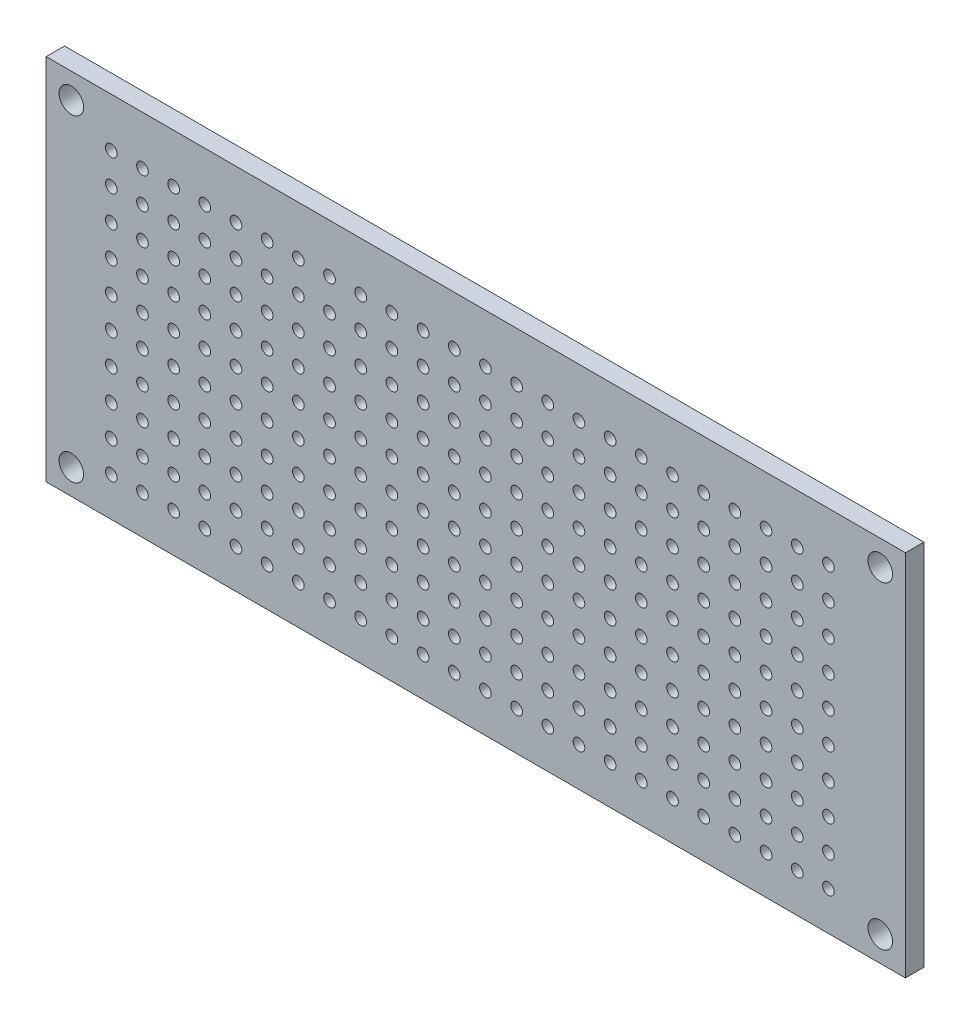
from build123d import *

# Parameters (mm, degrees)
SKIZZE1_W                       = 70
SKIZZE1_H                       = 30
SKIZZE1_R                       = 1
SKIZZE1_R_2                     = 0.475
AUFSATZ_LINEAR_AUSTRAGEN1_DEPTH = 1.5


with BuildPart() as part:
    # Skizze1 → Aufsatz-Linear austragen1 (new body)
    with BuildSketch(Plane.XY):
        with Locations((35, 15)):
            Rectangle(SKIZZE1_W, SKIZZE1_H)
        with Locations((67.95, 27.95)):
            Circle(SKIZZE1_R, mode=Mode.SUBTRACT)
        with Locations((67.95, 2.05)):
            Circle(SKIZZE1_R, mode=Mode.SUBTRACT)
        with Locations((2.05, 2.05)):
            Circle(SKIZZE1_R, mode=Mode.SUBTRACT)
        with Locations((2.05, 27.95)):
            Circle(SKIZZE1_R, mode=Mode.SUBTRACT)
        with Locations((63.725, 26.025)):
            Circle(SKIZZE1_R_2, mode=Mode.SUBTRACT)
        with Locations((61.185, 26.025)):
            Circle(SKIZZE1_R_2, mode=Mode.SUBTRACT)
        with Locations((58.645, 26.025)):
            Circle(SKIZZE1_R_2, mode=Mode.SUBTRACT)
        with Locations((56.105, 26.025)):
            Circle(SKIZZE1_R_2, mode=Mode.SUBTRACT)
        with Locations((53.565, 26.025)):
            Circle(SKIZZE1_R_2, mode=Mode.SUBTRACT)
        with Locations((51.025, 26.025)):
            Circle(SKIZZE1_R_2, mode=Mode.SUBTRACT)
        with Locations((48.485, 26.025)):
            Circle(SKIZZE1_R_2, mode=Mode.SUBTRACT)
        with Locations((45.945, 26.025)):
            Circle(SKIZZE1_R_2, mode=Mode.SUBTRACT)
        with Locations((43.405, 26.025)):
            Circle(SKIZZE1_R_2, mode=Mode.SUBTRACT)
        with Locations((40.865, 26.025)):
            Circle(SKIZZE1_R_2, mode=Mode.SUBTRACT)
        with Locations((38.325, 26.025)):
            Circle(SKIZZE1_R_2, mode=Mode.SUBTRACT)
        with Locations((35.785, 26.025)):
            Circle(SKIZZE1_R_2, mode=Mode.SUBTRACT)
        with Locations((33.245, 26.025)):
            Circle(SKIZZE1_R_2, mode=Mode.SUBTRACT)
        with Locations((30.705, 26.025)):
            Circle(SKIZZE1_R_2, mode=Mode.SUBTRACT)
        with Locations((28.165, 26.025)):
            Circle(SKIZZE1_R_2, mode=Mode.SUBTRACT)
        with Locations((25.625, 26.025)):
            Circle(SKIZZE1_R_2, mode=Mode.SUBTRACT)
        with Locations((23.085, 26.025)):
            Circle(SKIZZE1_R_2, mode=Mode.SUBTRACT)
        with Locations((20.545, 26.025)):
            Circle(SKIZZE1_R_2, mode=Mode.SUBTRACT)
        with Locations((18.005, 26.025)):
            Circle(SKIZZE1_R_2, mode=Mode.SUBTRACT)
        with Locations((15.465, 26.025)):
            Circle(SKIZZE1_R_2, mode=Mode.SUBTRACT)
        with Locations((12.925, 26.025)):
            Circle(SKIZZE1_R_2, mode=Mode.SUBTRACT)
        with Locations((10.385, 26.025)):
            Circle(SKIZZE1_R_2, mode=Mode.SUBTRACT)
        with Locations((7.845, 26.025)):
            Circle(SKIZZE1_R_2, mode=Mode.SUBTRACT)
        with Locations((5.305, 26.025)):
            Circle(SKIZZE1_R_2, mode=Mode.SUBTRACT)
        with Locations((61.185, 23.485)):
            Circle(SKIZZE1_R_2, mode=Mode.SUBTRACT)
        with Locations((58.645, 23.485)):
            Circle(SKIZZE1_R_2, mode=Mode.SUBTRACT)
        with Locations((56.105, 23.485)):
            Circle(SKIZZE1_R_2, mode=Mode.SUBTRACT)
        with Locations((53.565, 23.485)):
            Circle(SKIZZE1_R_2, mode=Mode.SUBTRACT)
        with Locations((51.025, 23.485)):
            Circle(SKIZZE1_R_2, mode=Mode.SUBTRACT)
        with Locations((48.485, 23.485)):
            Circle(SKIZZE1_R_2, mode=Mode.SUBTRACT)
        with Locations((45.945, 23.485)):
            Circle(SKIZZE1_R_2, mode=Mode.SUBTRACT)
        with Locations((43.405, 23.485)):
            Circle(SKIZZE1_R_2, mode=Mode.SUBTRACT)
        with Locations((40.865, 23.485)):
            Circle(SKIZZE1_R_2, mode=Mode.SUBTRACT)
        with Locations((38.325, 23.485)):
            Circle(SKIZZE1_R_2, mode=Mode.SUBTRACT)
        with Locations((35.785, 23.485)):
            Circle(SKIZZE1_R_2, mode=Mode.SUBTRACT)
        with Locations((33.245, 23.485)):
            Circle(SKIZZE1_R_2, mode=Mode.SUBTRACT)
        with Locations((30.705, 23.485)):
            Circle(SKIZZE1_R_2, mode=Mode.SUBTRACT)
        with Locations((28.165, 23.485)):
            Circle(SKIZZE1_R_2, mode=Mode.SUBTRACT)
        with Locations((25.625, 23.485)):
            Circle(SKIZZE1_R_2, mode=Mode.SUBTRACT)
        with Locations((23.085, 23.485)):
            Circle(SKIZZE1_R_2, mode=Mode.SUBTRACT)
        with Locations((20.545, 23.485)):
            Circle(SKIZZE1_R_2, mode=Mode.SUBTRACT)
        with Locations((18.005, 23.485)):
            Circle(SKIZZE1_R_2, mode=Mode.SUBTRACT)
        with Locations((15.465, 23.485)):
            Circle(SKIZZE1_R_2, mode=Mode.SUBTRACT)
        with Locations((12.925, 23.485)):
            Circle(SKIZZE1_R_2, mode=Mode.SUBTRACT)
        with Locations((10.385, 23.485)):
            Circle(SKIZZE1_R_2, mode=Mode.SUBTRACT)
        with Locations((7.845, 23.485)):
            Circle(SKIZZE1_R_2, mode=Mode.SUBTRACT)
        with Locations((5.305, 23.485)):
            Circle(SKIZZE1_R_2, mode=Mode.SUBTRACT)
        with Locations((61.185, 20.945)):
            Circle(SKIZZE1_R_2, mode=Mode.SUBTRACT)
        with Locations((58.645, 20.945)):
            Circle(SKIZZE1_R_2, mode=Mode.SUBTRACT)
        with Locations((56.105, 20.945)):
            Circle(SKIZZE1_R_2, mode=Mode.SUBTRACT)
        with Locations((53.565, 20.945)):
            Circle(SKIZZE1_R_2, mode=Mode.SUBTRACT)
        with Locations((51.025, 20.945)):
            Circle(SKIZZE1_R_2, mode=Mode.SUBTRACT)
        with Locations((48.485, 20.945)):
            Circle(SKIZZE1_R_2, mode=Mode.SUBTRACT)
        with Locations((45.945, 20.945)):
            Circle(SKIZZE1_R_2, mode=Mode.SUBTRACT)
        with Locations((43.405, 20.945)):
            Circle(SKIZZE1_R_2, mode=Mode.SUBTRACT)
        with Locations((40.865, 20.945)):
            Circle(SKIZZE1_R_2, mode=Mode.SUBTRACT)
        with Locations((38.325, 20.945)):
            Circle(SKIZZE1_R_2, mode=Mode.SUBTRACT)
        with Locations((35.785, 20.945)):
            Circle(SKIZZE1_R_2, mode=Mode.SUBTRACT)
        with Locations((33.245, 20.945)):
            Circle(SKIZZE1_R_2, mode=Mode.SUBTRACT)
        with Locations((30.705, 20.945)):
            Circle(SKIZZE1_R_2, mode=Mode.SUBTRACT)
        with Locations((28.165, 20.945)):
            Circle(SKIZZE1_R_2, mode=Mode.SUBTRACT)
        with Locations((25.625, 20.945)):
            Circle(SKIZZE1_R_2, mode=Mode.SUBTRACT)
        with Locations((23.085, 20.945)):
            Circle(SKIZZE1_R_2, mode=Mode.SUBTRACT)
        with Locations((20.545, 20.945)):
            Circle(SKIZZE1_R_2, mode=Mode.SUBTRACT)
        with Locations((18.005, 20.945)):
            Circle(SKIZZE1_R_2, mode=Mode.SUBTRACT)
        with Locations((15.465, 20.945)):
            Circle(SKIZZE1_R_2, mode=Mode.SUBTRACT)
        with Locations((12.925, 20.945)):
            Circle(SKIZZE1_R_2, mode=Mode.SUBTRACT)
        with Locations((10.385, 20.945)):
            Circle(SKIZZE1_R_2, mode=Mode.SUBTRACT)
        with Locations((7.845, 20.945)):
            Circle(SKIZZE1_R_2, mode=Mode.SUBTRACT)
        with Locations((5.305, 20.945)):
            Circle(SKIZZE1_R_2, mode=Mode.SUBTRACT)
        with Locations((61.185, 18.405)):
            Circle(SKIZZE1_R_2, mode=Mode.SUBTRACT)
        with Locations((58.645, 18.405)):
            Circle(SKIZZE1_R_2, mode=Mode.SUBTRACT)
        with Locations((56.105, 18.405)):
            Circle(SKIZZE1_R_2, mode=Mode.SUBTRACT)
        with Locations((53.565, 18.405)):
            Circle(SKIZZE1_R_2, mode=Mode.SUBTRACT)
        with Locations((51.025, 18.405)):
            Circle(SKIZZE1_R_2, mode=Mode.SUBTRACT)
        with Locations((48.485, 18.405)):
            Circle(SKIZZE1_R_2, mode=Mode.SUBTRACT)
        with Locations((45.945, 18.405)):
            Circle(SKIZZE1_R_2, mode=Mode.SUBTRACT)
        with Locations((43.405, 18.405)):
            Circle(SKIZZE1_R_2, mode=Mode.SUBTRACT)
        with Locations((40.865, 18.405)):
            Circle(SKIZZE1_R_2, mode=Mode.SUBTRACT)
        with Locations((38.325, 18.405)):
            Circle(SKIZZE1_R_2, mode=Mode.SUBTRACT)
        with Locations((35.785, 18.405)):
            Circle(SKIZZE1_R_2, mode=Mode.SUBTRACT)
        with Locations((33.245, 18.405)):
            Circle(SKIZZE1_R_2, mode=Mode.SUBTRACT)
        with Locations((30.705, 18.405)):
            Circle(SKIZZE1_R_2, mode=Mode.SUBTRACT)
        with Locations((28.165, 18.405)):
            Circle(SKIZZE1_R_2, mode=Mode.SUBTRACT)
        with Locations((25.625, 18.405)):
            Circle(SKIZZE1_R_2, mode=Mode.SUBTRACT)
        with Locations((23.085, 18.405)):
            Circle(SKIZZE1_R_2, mode=Mode.SUBTRACT)
        with Locations((20.545, 18.405)):
            Circle(SKIZZE1_R_2, mode=Mode.SUBTRACT)
        with Locations((18.005, 18.405)):
            Circle(SKIZZE1_R_2, mode=Mode.SUBTRACT)
        with Locations((15.465, 18.405)):
            Circle(SKIZZE1_R_2, mode=Mode.SUBTRACT)
        with Locations((12.925, 18.405)):
            Circle(SKIZZE1_R_2, mode=Mode.SUBTRACT)
        with Locations((10.385, 18.405)):
            Circle(SKIZZE1_R_2, mode=Mode.SUBTRACT)
        with Locations((7.845, 18.405)):
            Circle(SKIZZE1_R_2, mode=Mode.SUBTRACT)
        with Locations((5.305, 18.405)):
            Circle(SKIZZE1_R_2, mode=Mode.SUBTRACT)
        with Locations((61.185, 15.865)):
            Circle(SKIZZE1_R_2, mode=Mode.SUBTRACT)
        with Locations((58.645, 15.865)):
            Circle(SKIZZE1_R_2, mode=Mode.SUBTRACT)
        with Locations((56.105, 15.865)):
            Circle(SKIZZE1_R_2, mode=Mode.SUBTRACT)
        with Locations((53.565, 15.865)):
            Circle(SKIZZE1_R_2, mode=Mode.SUBTRACT)
        with Locations((51.025, 15.865)):
            Circle(SKIZZE1_R_2, mode=Mode.SUBTRACT)
        with Locations((48.485, 15.865)):
            Circle(SKIZZE1_R_2, mode=Mode.SUBTRACT)
        with Locations((45.945, 15.865)):
            Circle(SKIZZE1_R_2, mode=Mode.SUBTRACT)
        with Locations((43.405, 15.865)):
            Circle(SKIZZE1_R_2, mode=Mode.SUBTRACT)
        with Locations((40.865, 15.865)):
            Circle(SKIZZE1_R_2, mode=Mode.SUBTRACT)
        with Locations((38.325, 15.865)):
            Circle(SKIZZE1_R_2, mode=Mode.SUBTRACT)
        with Locations((35.785, 15.865)):
            Circle(SKIZZE1_R_2, mode=Mode.SUBTRACT)
        with Locations((33.245, 15.865)):
            Circle(SKIZZE1_R_2, mode=Mode.SUBTRACT)
        with Locations((30.705, 15.865)):
            Circle(SKIZZE1_R_2, mode=Mode.SUBTRACT)
        with Locations((28.165, 15.865)):
            Circle(SKIZZE1_R_2, mode=Mode.SUBTRACT)
        with Locations((25.625, 15.865)):
            Circle(SKIZZE1_R_2, mode=Mode.SUBTRACT)
        with Locations((23.085, 15.865)):
            Circle(SKIZZE1_R_2, mode=Mode.SUBTRACT)
        with Locations((20.545, 15.865)):
            Circle(SKIZZE1_R_2, mode=Mode.SUBTRACT)
        with Locations((18.005, 15.865)):
            Circle(SKIZZE1_R_2, mode=Mode.SUBTRACT)
        with Locations((15.465, 15.865)):
            Circle(SKIZZE1_R_2, mode=Mode.SUBTRACT)
        with Locations((12.925, 15.865)):
            Circle(SKIZZE1_R_2, mode=Mode.SUBTRACT)
        with Locations((10.385, 15.865)):
            Circle(SKIZZE1_R_2, mode=Mode.SUBTRACT)
        with Locations((7.845, 15.865)):
            Circle(SKIZZE1_R_2, mode=Mode.SUBTRACT)
        with Locations((5.305, 15.865)):
            Circle(SKIZZE1_R_2, mode=Mode.SUBTRACT)
        with Locations((61.185, 13.325)):
            Circle(SKIZZE1_R_2, mode=Mode.SUBTRACT)
        with Locations((58.645, 13.325)):
            Circle(SKIZZE1_R_2, mode=Mode.SUBTRACT)
        with Locations((56.105, 13.325)):
            Circle(SKIZZE1_R_2, mode=Mode.SUBTRACT)
        with Locations((53.565, 13.325)):
            Circle(SKIZZE1_R_2, mode=Mode.SUBTRACT)
        with Locations((51.025, 13.325)):
            Circle(SKIZZE1_R_2, mode=Mode.SUBTRACT)
        with Locations((48.485, 13.325)):
            Circle(SKIZZE1_R_2, mode=Mode.SUBTRACT)
        with Locations((45.945, 13.325)):
            Circle(SKIZZE1_R_2, mode=Mode.SUBTRACT)
        with Locations((43.405, 13.325)):
            Circle(SKIZZE1_R_2, mode=Mode.SUBTRACT)
        with Locations((40.865, 13.325)):
            Circle(SKIZZE1_R_2, mode=Mode.SUBTRACT)
        with Locations((38.325, 13.325)):
            Circle(SKIZZE1_R_2, mode=Mode.SUBTRACT)
        with Locations((35.785, 13.325)):
            Circle(SKIZZE1_R_2, mode=Mode.SUBTRACT)
        with Locations((33.245, 13.325)):
            Circle(SKIZZE1_R_2, mode=Mode.SUBTRACT)
        with Locations((30.705, 13.325)):
            Circle(SKIZZE1_R_2, mode=Mode.SUBTRACT)
        with Locations((28.165, 13.325)):
            Circle(SKIZZE1_R_2, mode=Mode.SUBTRACT)
        with Locations((25.625, 13.325)):
            Circle(SKIZZE1_R_2, mode=Mode.SUBTRACT)
        with Locations((23.085, 13.325)):
            Circle(SKIZZE1_R_2, mode=Mode.SUBTRACT)
        with Locations((20.545, 13.325)):
            Circle(SKIZZE1_R_2, mode=Mode.SUBTRACT)
        with Locations((18.005, 13.325)):
            Circle(SKIZZE1_R_2, mode=Mode.SUBTRACT)
        with Locations((15.465, 13.325)):
            Circle(SKIZZE1_R_2, mode=Mode.SUBTRACT)
        with Locations((12.925, 13.325)):
            Circle(SKIZZE1_R_2, mode=Mode.SUBTRACT)
        with Locations((10.385, 13.325)):
            Circle(SKIZZE1_R_2, mode=Mode.SUBTRACT)
        with Locations((7.845, 13.325)):
            Circle(SKIZZE1_R_2, mode=Mode.SUBTRACT)
        with Locations((5.305, 13.325)):
            Circle(SKIZZE1_R_2, mode=Mode.SUBTRACT)
        with Locations((61.185, 10.785)):
            Circle(SKIZZE1_R_2, mode=Mode.SUBTRACT)
        with Locations((58.645, 10.785)):
            Circle(SKIZZE1_R_2, mode=Mode.SUBTRACT)
        with Locations((56.105, 10.785)):
            Circle(SKIZZE1_R_2, mode=Mode.SUBTRACT)
        with Locations((53.565, 10.785)):
            Circle(SKIZZE1_R_2, mode=Mode.SUBTRACT)
        with Locations((51.025, 10.785)):
            Circle(SKIZZE1_R_2, mode=Mode.SUBTRACT)
        with Locations((48.485, 10.785)):
            Circle(SKIZZE1_R_2, mode=Mode.SUBTRACT)
        with Locations((45.945, 10.785)):
            Circle(SKIZZE1_R_2, mode=Mode.SUBTRACT)
        with Locations((43.405, 10.785)):
            Circle(SKIZZE1_R_2, mode=Mode.SUBTRACT)
        with Locations((40.865, 10.785)):
            Circle(SKIZZE1_R_2, mode=Mode.SUBTRACT)
        with Locations((38.325, 10.785)):
            Circle(SKIZZE1_R_2, mode=Mode.SUBTRACT)
        with Locations((35.785, 10.785)):
            Circle(SKIZZE1_R_2, mode=Mode.SUBTRACT)
        with Locations((33.245, 10.785)):
            Circle(SKIZZE1_R_2, mode=Mode.SUBTRACT)
        with Locations((30.705, 10.785)):
            Circle(SKIZZE1_R_2, mode=Mode.SUBTRACT)
        with Locations((28.165, 10.785)):
            Circle(SKIZZE1_R_2, mode=Mode.SUBTRACT)
        with Locations((25.625, 10.785)):
            Circle(SKIZZE1_R_2, mode=Mode.SUBTRACT)
        with Locations((23.085, 10.785)):
            Circle(SKIZZE1_R_2, mode=Mode.SUBTRACT)
        with Locations((20.545, 10.785)):
            Circle(SKIZZE1_R_2, mode=Mode.SUBTRACT)
        with Locations((18.005, 10.785)):
            Circle(SKIZZE1_R_2, mode=Mode.SUBTRACT)
        with Locations((15.465, 10.785)):
            Circle(SKIZZE1_R_2, mode=Mode.SUBTRACT)
        with Locations((12.925, 10.785)):
            Circle(SKIZZE1_R_2, mode=Mode.SUBTRACT)
        with Locations((10.385, 10.785)):
            Circle(SKIZZE1_R_2, mode=Mode.SUBTRACT)
        with Locations((7.845, 10.785)):
            Circle(SKIZZE1_R_2, mode=Mode.SUBTRACT)
        with Locations((5.305, 10.785)):
            Circle(SKIZZE1_R_2, mode=Mode.SUBTRACT)
        with Locations((61.185, 8.245)):
            Circle(SKIZZE1_R_2, mode=Mode.SUBTRACT)
        with Locations((58.645, 8.245)):
            Circle(SKIZZE1_R_2, mode=Mode.SUBTRACT)
        with Locations((56.105, 8.245)):
            Circle(SKIZZE1_R_2, mode=Mode.SUBTRACT)
        with Locations((53.565, 8.245)):
            Circle(SKIZZE1_R_2, mode=Mode.SUBTRACT)
        with Locations((51.025, 8.245)):
            Circle(SKIZZE1_R_2, mode=Mode.SUBTRACT)
        with Locations((48.485, 8.245)):
            Circle(SKIZZE1_R_2, mode=Mode.SUBTRACT)
        with Locations((45.945, 8.245)):
            Circle(SKIZZE1_R_2, mode=Mode.SUBTRACT)
        with Locations((43.405, 8.245)):
            Circle(SKIZZE1_R_2, mode=Mode.SUBTRACT)
        with Locations((40.865, 8.245)):
            Circle(SKIZZE1_R_2, mode=Mode.SUBTRACT)
        with Locations((38.325, 8.245)):
            Circle(SKIZZE1_R_2, mode=Mode.SUBTRACT)
        with Locations((35.785, 8.245)):
            Circle(SKIZZE1_R_2, mode=Mode.SUBTRACT)
        with Locations((33.245, 8.245)):
            Circle(SKIZZE1_R_2, mode=Mode.SUBTRACT)
        with Locations((30.705, 8.245)):
            Circle(SKIZZE1_R_2, mode=Mode.SUBTRACT)
        with Locations((28.165, 8.245)):
            Circle(SKIZZE1_R_2, mode=Mode.SUBTRACT)
        with Locations((25.625, 8.245)):
            Circle(SKIZZE1_R_2, mode=Mode.SUBTRACT)
        with Locations((23.085, 8.245)):
            Circle(SKIZZE1_R_2, mode=Mode.SUBTRACT)
        with Locations((20.545, 8.245)):
            Circle(SKIZZE1_R_2, mode=Mode.SUBTRACT)
        with Locations((18.005, 8.245)):
            Circle(SKIZZE1_R_2, mode=Mode.SUBTRACT)
        with Locations((15.465, 8.245)):
            Circle(SKIZZE1_R_2, mode=Mode.SUBTRACT)
        with Locations((12.925, 8.245)):
            Circle(SKIZZE1_R_2, mode=Mode.SUBTRACT)
        with Locations((10.385, 8.245)):
            Circle(SKIZZE1_R_2, mode=Mode.SUBTRACT)
        with Locations((7.845, 8.245)):
            Circle(SKIZZE1_R_2, mode=Mode.SUBTRACT)
        with Locations((5.305, 8.245)):
            Circle(SKIZZE1_R_2, mode=Mode.SUBTRACT)
        with Locations((61.185, 5.705)):
            Circle(SKIZZE1_R_2, mode=Mode.SUBTRACT)
        with Locations((58.645, 5.705)):
            Circle(SKIZZE1_R_2, mode=Mode.SUBTRACT)
        with Locations((56.105, 5.705)):
            Circle(SKIZZE1_R_2, mode=Mode.SUBTRACT)
        with Locations((53.565, 5.705)):
            Circle(SKIZZE1_R_2, mode=Mode.SUBTRACT)
        with Locations((51.025, 5.705)):
            Circle(SKIZZE1_R_2, mode=Mode.SUBTRACT)
        with Locations((48.485, 5.705)):
            Circle(SKIZZE1_R_2, mode=Mode.SUBTRACT)
        with Locations((45.945, 5.705)):
            Circle(SKIZZE1_R_2, mode=Mode.SUBTRACT)
        with Locations((43.405, 5.705)):
            Circle(SKIZZE1_R_2, mode=Mode.SUBTRACT)
        with Locations((40.865, 5.705)):
            Circle(SKIZZE1_R_2, mode=Mode.SUBTRACT)
        with Locations((38.325, 5.705)):
            Circle(SKIZZE1_R_2, mode=Mode.SUBTRACT)
        with Locations((35.785, 5.705)):
            Circle(SKIZZE1_R_2, mode=Mode.SUBTRACT)
        with Locations((33.245, 5.705)):
            Circle(SKIZZE1_R_2, mode=Mode.SUBTRACT)
        with Locations((30.705, 5.705)):
            Circle(SKIZZE1_R_2, mode=Mode.SUBTRACT)
        with Locations((28.165, 5.705)):
            Circle(SKIZZE1_R_2, mode=Mode.SUBTRACT)
        with Locations((25.625, 5.705)):
            Circle(SKIZZE1_R_2, mode=Mode.SUBTRACT)
        with Locations((23.085, 5.705)):
            Circle(SKIZZE1_R_2, mode=Mode.SUBTRACT)
        with Locations((20.545, 5.705)):
            Circle(SKIZZE1_R_2, mode=Mode.SUBTRACT)
        with Locations((18.005, 5.705)):
            Circle(SKIZZE1_R_2, mode=Mode.SUBTRACT)
        with Locations((15.465, 5.705)):
            Circle(SKIZZE1_R_2, mode=Mode.SUBTRACT)
        with Locations((12.925, 5.705)):
            Circle(SKIZZE1_R_2, mode=Mode.SUBTRACT)
        with Locations((10.385, 5.705)):
            Circle(SKIZZE1_R_2, mode=Mode.SUBTRACT)
        with Locations((7.845, 5.705)):
            Circle(SKIZZE1_R_2, mode=Mode.SUBTRACT)
        with Locations((5.305, 5.705)):
            Circle(SKIZZE1_R_2, mode=Mode.SUBTRACT)
        with Locations((61.185, 3.165)):
            Circle(SKIZZE1_R_2, mode=Mode.SUBTRACT)
        with Locations((58.645, 3.165)):
            Circle(SKIZZE1_R_2, mode=Mode.SUBTRACT)
        with Locations((56.105, 3.165)):
            Circle(SKIZZE1_R_2, mode=Mode.SUBTRACT)
        with Locations((53.565, 3.165)):
            Circle(SKIZZE1_R_2, mode=Mode.SUBTRACT)
        with Locations((51.025, 3.165)):
            Circle(SKIZZE1_R_2, mode=Mode.SUBTRACT)
        with Locations((48.485, 3.165)):
            Circle(SKIZZE1_R_2, mode=Mode.SUBTRACT)
        with Locations((45.945, 3.165)):
            Circle(SKIZZE1_R_2, mode=Mode.SUBTRACT)
        with Locations((43.405, 3.165)):
            Circle(SKIZZE1_R_2, mode=Mode.SUBTRACT)
        with Locations((40.865, 3.165)):
            Circle(SKIZZE1_R_2, mode=Mode.SUBTRACT)
        with Locations((38.325, 3.165)):
            Circle(SKIZZE1_R_2, mode=Mode.SUBTRACT)
        with Locations((35.785, 3.165)):
            Circle(SKIZZE1_R_2, mode=Mode.SUBTRACT)
        with Locations((33.245, 3.165)):
            Circle(SKIZZE1_R_2, mode=Mode.SUBTRACT)
        with Locations((30.705, 3.165)):
            Circle(SKIZZE1_R_2, mode=Mode.SUBTRACT)
        with Locations((28.165, 3.165)):
            Circle(SKIZZE1_R_2, mode=Mode.SUBTRACT)
        with Locations((25.625, 3.165)):
            Circle(SKIZZE1_R_2, mode=Mode.SUBTRACT)
        with Locations((23.085, 3.165)):
            Circle(SKIZZE1_R_2, mode=Mode.SUBTRACT)
        with Locations((20.545, 3.165)):
            Circle(SKIZZE1_R_2, mode=Mode.SUBTRACT)
        with Locations((18.005, 3.165)):
            Circle(SKIZZE1_R_2, mode=Mode.SUBTRACT)
        with Locations((15.465, 3.165)):
            Circle(SKIZZE1_R_2, mode=Mode.SUBTRACT)
        with Locations((12.925, 3.165)):
            Circle(SKIZZE1_R_2, mode=Mode.SUBTRACT)
        with Locations((10.385, 3.165)):
            Circle(SKIZZE1_R_2, mode=Mode.SUBTRACT)
        with Locations((7.845, 3.165)):
            Circle(SKIZZE1_R_2, mode=Mode.SUBTRACT)
        with Locations((5.305, 3.165)):
            Circle(SKIZZE1_R_2, mode=Mode.SUBTRACT)
        with Locations((63.725, 23.485)):
            Circle(SKIZZE1_R_2, mode=Mode.SUBTRACT)
        with Locations((63.725, 20.945)):
            Circle(SKIZZE1_R_2, mode=Mode.SUBTRACT)
        with Locations((63.725, 18.405)):
            Circle(SKIZZE1_R_2, mode=Mode.SUBTRACT)
        with Locations((63.725, 15.865)):
            Circle(SKIZZE1_R_2, mode=Mode.SUBTRACT)
        with Locations((63.725, 13.325)):
            Circle(SKIZZE1_R_2, mode=Mode.SUBTRACT)
        with Locations((63.725, 10.785)):
            Circle(SKIZZE1_R_2, mode=Mode.SUBTRACT)
        with Locations((63.725, 8.245)):
            Circle(SKIZZE1_R_2, mode=Mode.SUBTRACT)
        with Locations((63.725, 5.705)):
            Circle(SKIZZE1_R_2, mode=Mode.SUBTRACT)
        with Locations((63.725, 3.165)):
            Circle(SKIZZE1_R_2, mode=Mode.SUBTRACT)
    extrude(amount=AUFSATZ_LINEAR_AUSTRAGEN1_DEPTH)


solid = part.part
